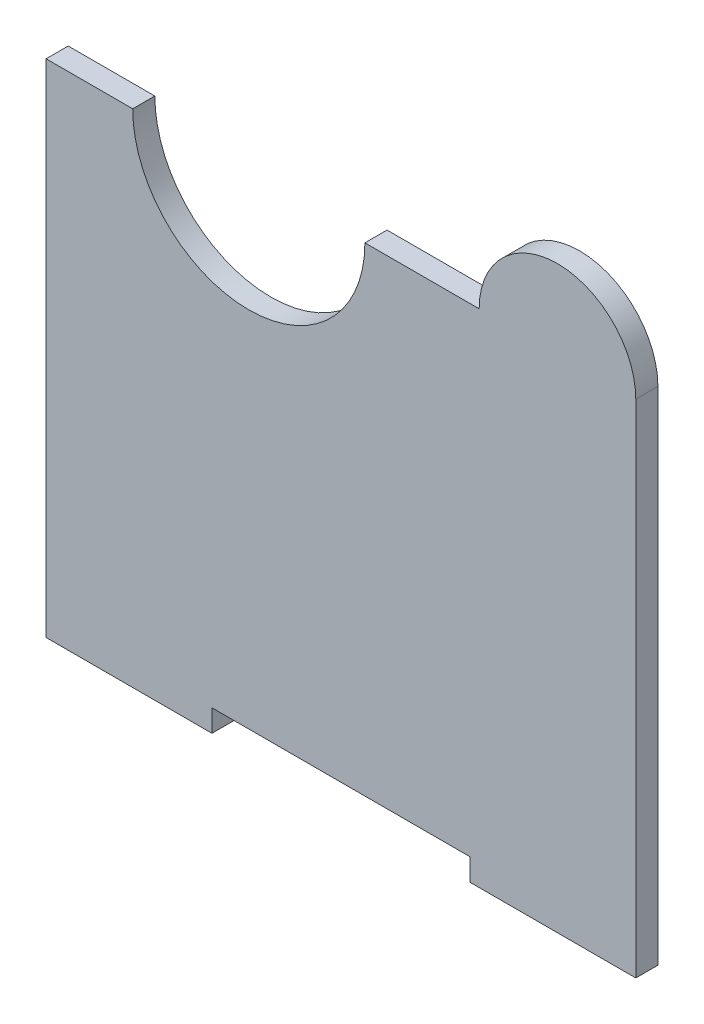
from build123d import *

# Parameters (mm, degrees)
BOSS_EXTRUDE1_DEPTH = 6


with BuildPart() as part:
    # Sketch1 → Boss-Extrude1 (new body)
    with BuildSketch(Plane.XY):
        with BuildLine():
            Line((-55, 0), (-31.5, 0))
            ThreePointArc((-31.5, 0), (0, -31.5), (31.5, 0))
            Line((31.5, 0), (62.5, 0))
            ThreePointArc((62.5, 0), (83.75, 21.25), (105, 0))
            Line((105, 0), (105, -136))
            Line((105, -136), (60, -136))
            Line((60, -136), (60, -130))
            Line((60, -130), (-10, -130))
            Line((-10, -130), (-10, -136))
            Line((-10, -136), (-55, -136))
            Line((-55, -136), (-55, 0))
        make_face()
    extrude(amount=BOSS_EXTRUDE1_DEPTH)


solid = part.part
